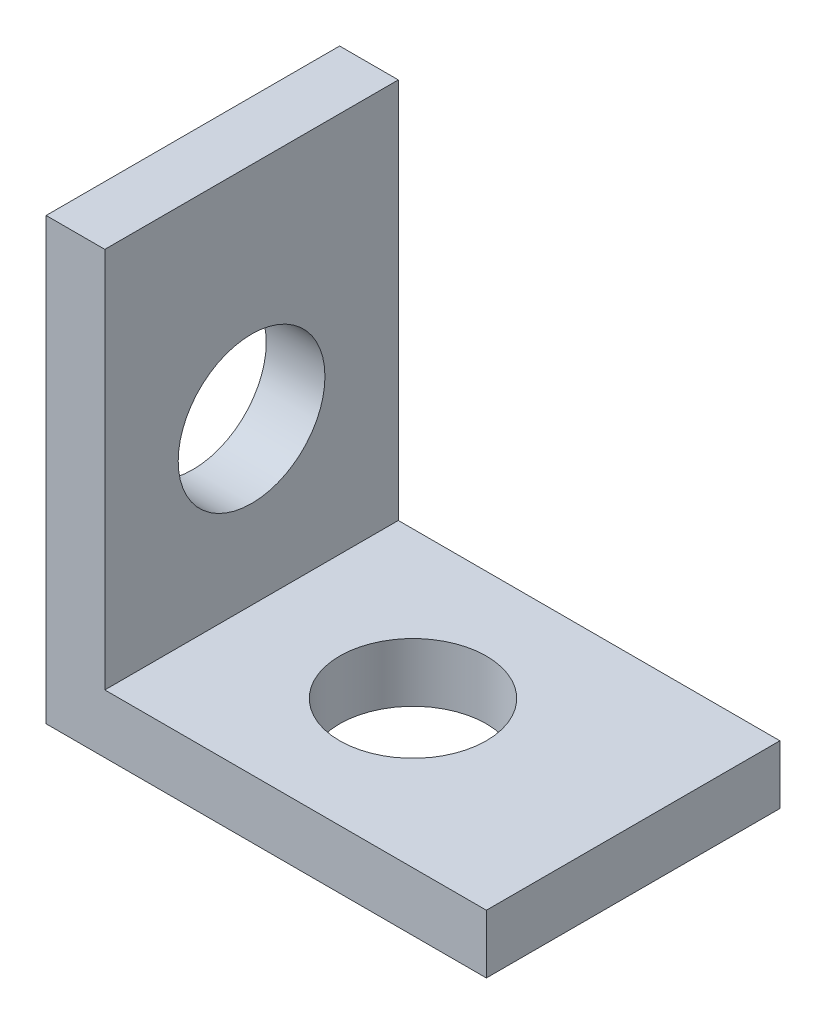
from build123d import *

# Parameters (mm, degrees)
EXTRUDE_1_DEPTH     = 10
SKETCH_2_R          = 2.5
CUT_EXTRUDE_1_DEPTH = 10
SKETCH_3_R          = 2.5
CUT_EXTRUDE_2_DEPTH = 10


with BuildPart() as part:
    # 草图1 → 凸台-拉伸1 (new body)
    with BuildSketch(Plane.XY):
        Polygon((0, 0), (13, 0), (13, -2), (-2, -2), (-2, 13), (0, 13), align=None)
    extrude(amount=EXTRUDE_1_DEPTH)

    # 草图2 → 切除-拉伸1 (cut)
    with BuildSketch(Plane.XZ.offset(2)):
        with Locations((5.5, 5)):
            Circle(SKETCH_2_R)
    extrude(amount=-CUT_EXTRUDE_1_DEPTH, mode=Mode.SUBTRACT)

    # 草图3 → 切除-拉伸2 (cut)
    with BuildSketch(Plane.ZY.offset(2)):
        with Locations((5, 5.5)):
            Circle(SKETCH_3_R)
    extrude(amount=-CUT_EXTRUDE_2_DEPTH, mode=Mode.SUBTRACT)


solid = part.part
